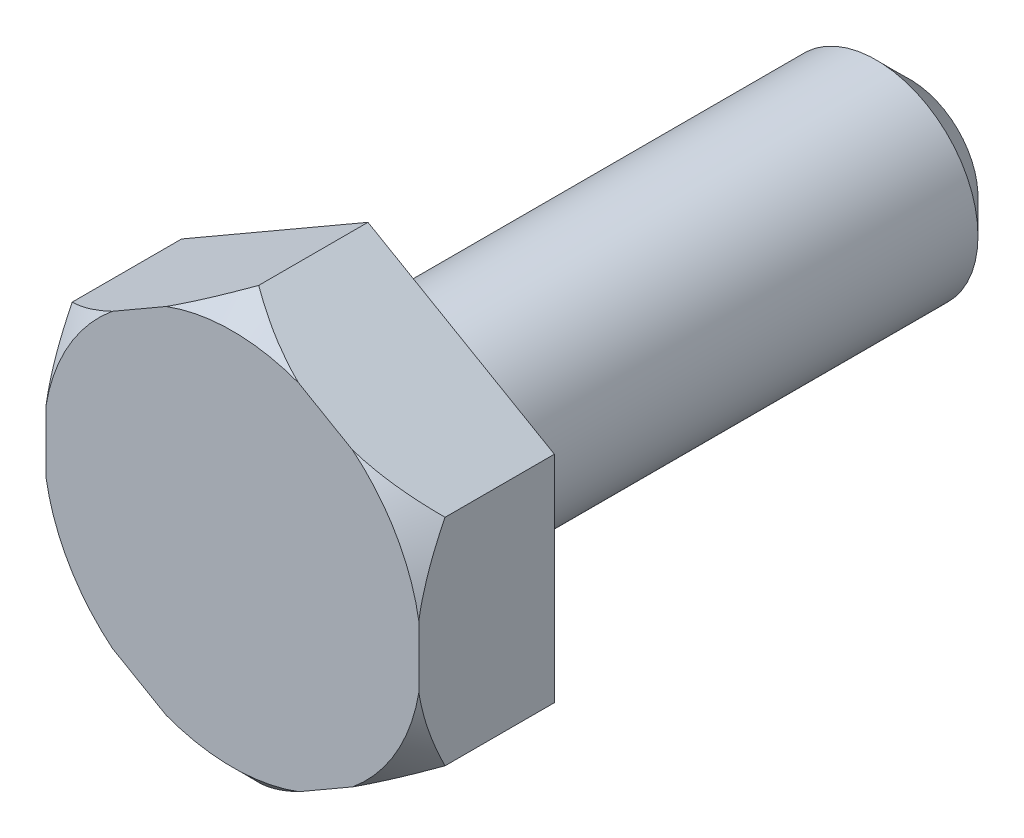
from build123d import *

# Parameters (mm, degrees)
EXTRUDE_1_DEPTH = 2
SKETCH_2_R      = 1.5
EXTRUDE_2_DEPTH = 8
CHAMFER_1_SIZE  = 0.5


with BuildPart() as part:
    # Эскиз1 → Вытянуть1 (new body)
    with BuildSketch(Plane.XY):
        Polygon((0, 3.175426481), (-2.75, 1.58771324), (-2.75, -1.58771324), (0, -3.175426481), (2.75, -1.58771324), (2.75, 1.58771324), align=None)
    extrude(amount=EXTRUDE_1_DEPTH)

    # Эскиз2 → Вытянуть2 (add)
    with BuildSketch(Plane(origin=(0, 0, 0), x_dir=(-1, 0, 0), z_dir=(0, 0, -1))):
        with Locations(Location((0, 0, 0), (0, 0, 180))):
            Circle(SKETCH_2_R)
    extrude(amount=EXTRUDE_2_DEPTH)

    # Эскиз15 → Вырез-Повернуть1 (revolve, cut)
    with BuildSketch(Plane(origin=(0, 0, 0), x_dir=(0, 0, -1), z_dir=(1, 0, 0))):
        Polygon((-2, 3.175426481), (-2, 2.787926481), (-1.6125, 3.175426481), align=None)
    revolve(axis=Axis((0, 0, 4.465296569), (0, 0, -1)), mode=Mode.SUBTRACT)

    # Фаска1
    chamfer_1_edges = [part.edges().sort_by_distance(p)[0] for p in [
        (-1.5, 0, -8),
    ]]
    chamfer(chamfer_1_edges, length=CHAMFER_1_SIZE)


solid = part.part
